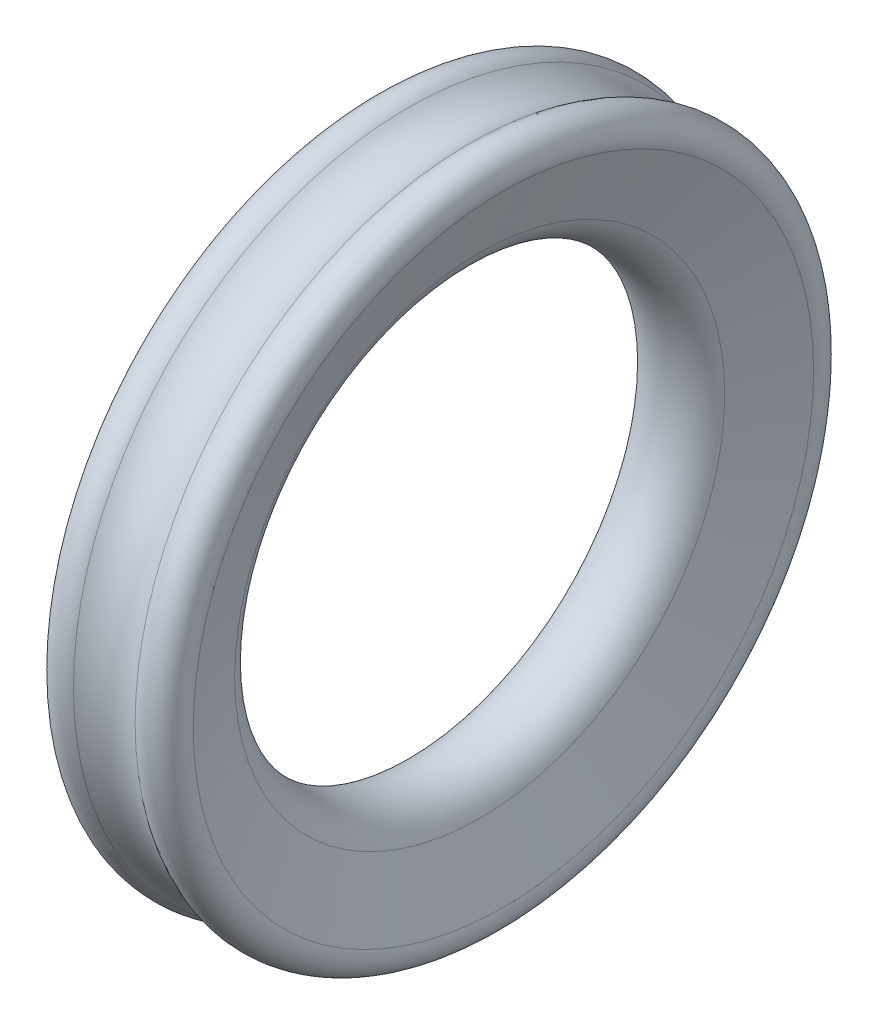
from build123d import *


with BuildPart() as part:
    # Sketch2 → Revolve1 (revolve)
    with BuildSketch(Plane.XY, mode=Mode.PRIVATE) as revolve1_sk:
        with BuildLine():
            Line((5.638155725, 33.94787914), (8.923373054, 42.97393957))
            ThreePointArc((8.923373054, 42.97393957), (7.875677675, 46.421198897), (4.273006634, 46.376211737))
            ThreePointArc((4.273006634, 46.376211737), (0, 44.92070579), (-4.273006634, 46.376211737))
            ThreePointArc((-4.273006634, 46.376211737), (-7.875677675, 46.421198897), (-8.923373054, 42.97393957))
            Line((-8.923373054, 42.97393957), (-5.638155725, 33.94787914))
            ThreePointArc((-5.638155725, 33.94787914), (0, 30), (5.638155725, 33.94787914))
        make_face()
    revolve(revolve1_sk.sketch.rotate(Axis((0, 0, 0), (1, 0, 0)), 90), axis=Axis((0, 0, 0), (1, 0, 0)))


solid = part.part
